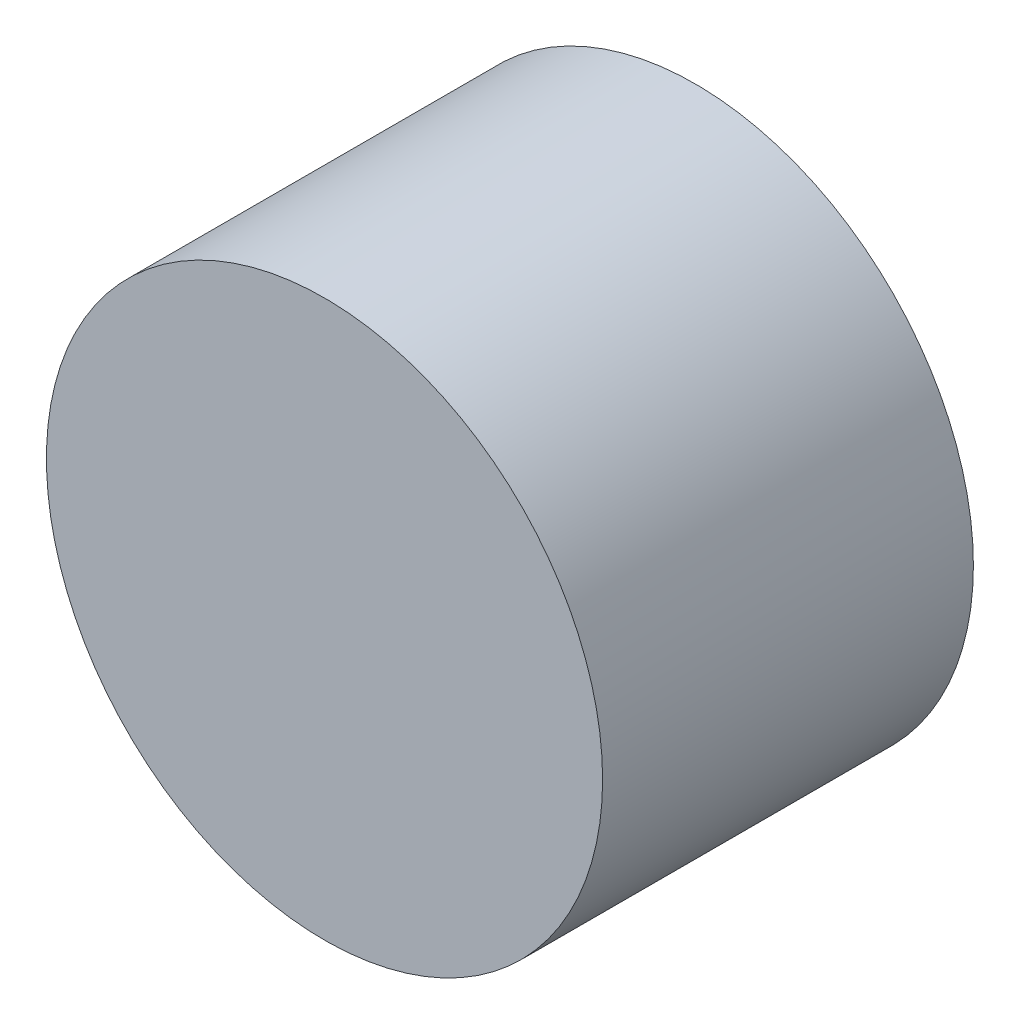
from build123d import *

# Parameters (mm, degrees)
ESQUISSE1_R        = 1.5
BOSS_EXTRU_1_DEPTH = 2


with BuildPart() as part:
    # Esquisse1 → Boss.-Extru.1 (new body)
    with BuildSketch(Plane.XY):
        Circle(ESQUISSE1_R)
    extrude(amount=BOSS_EXTRU_1_DEPTH)


solid = part.part
